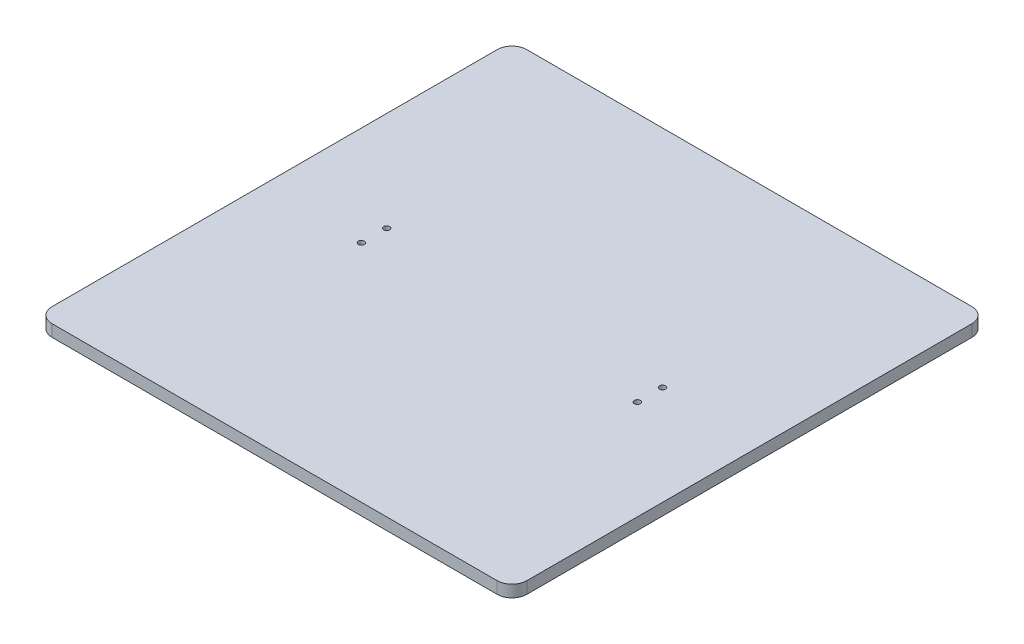
from build123d import *

# Parameters (mm, degrees)
EXTRUDE_1_DEPTH     = 8
CUT_EXTRUDE_1_REACH = 228.416
SKETCH_2_R          = 2


with BuildPart() as part:
    # 草图1 → 凸台-拉伸1 (new body)
    with BuildSketch(Plane(origin=(0, 0, 0), x_dir=(1, 0, 0), z_dir=(0, 1, 0))):
        with BuildLine():
            Line((-150, -160), (150, -160))
            ThreePointArc((150, -160), (157.071067812, -157.071067812), (160, -150))
            Line((160, -150), (160, 150))
            ThreePointArc((160, 150), (157.071067812, 157.071067812), (150, 160))
            Line((150, 160), (-150, 160))
            ThreePointArc((-150, 160), (-157.071067812, 157.071067812), (-160, 150))
            Line((-160, 150), (-160, -150))
            ThreePointArc((-160, -150), (-157.071067812, -157.071067812), (-150, -160))
        make_face()
    extrude(amount=-EXTRUDE_1_DEPTH)

    # 草图2 → 切除-拉伸1 (cut, up to next)
    with BuildSketch(Plane.XZ.offset(8), mode=Mode.PRIVATE) as cut_extrude_1_sk1:
        with Locations(Location((-93, 8.5, 0), (0, 0, 270))):
            Circle(SKETCH_2_R)
    cut_extrude_1_tool1 = extrude(cut_extrude_1_sk1.sketch, amount=-CUT_EXTRUDE_1_REACH, mode=Mode.PRIVATE) & part.part
    # 草图2 → 切除-拉伸1 (cut, up to next)
    with BuildSketch(Plane.XZ.offset(8), mode=Mode.PRIVATE) as cut_extrude_1_sk2:
        with Locations(Location((93, 8.5, 0), (0, 0, 270))):
            Circle(SKETCH_2_R)
    cut_extrude_1_tool2 = extrude(cut_extrude_1_sk2.sketch, amount=-CUT_EXTRUDE_1_REACH, mode=Mode.PRIVATE) & part.part
    # 草图2 → 切除-拉伸1 (cut, up to next)
    with BuildSketch(Plane.XZ.offset(8), mode=Mode.PRIVATE) as cut_extrude_1_sk3:
        with Locations(Location((93, -8.5, 0), (0, 0, 270))):
            Circle(SKETCH_2_R)
    cut_extrude_1_tool3 = extrude(cut_extrude_1_sk3.sketch, amount=-CUT_EXTRUDE_1_REACH, mode=Mode.PRIVATE) & part.part
    # 草图2 → 切除-拉伸1 (cut, up to next)
    with BuildSketch(Plane.XZ.offset(8), mode=Mode.PRIVATE) as cut_extrude_1_sk4:
        with Locations(Location((-93, -8.5, 0), (0, 0, 270))):
            Circle(SKETCH_2_R)
    cut_extrude_1_tool4 = extrude(cut_extrude_1_sk4.sketch, amount=-CUT_EXTRUDE_1_REACH, mode=Mode.PRIVATE) & part.part
    add(cut_extrude_1_tool1.solids().sort_by_distance((-93, -8, 8.5))[0], mode=Mode.SUBTRACT)
    add(cut_extrude_1_tool2.solids().sort_by_distance((93, -8, 8.5))[0], mode=Mode.SUBTRACT)
    add(cut_extrude_1_tool3.solids().sort_by_distance((93, -8, -8.5))[0], mode=Mode.SUBTRACT)
    add(cut_extrude_1_tool4.solids().sort_by_distance((-93, -8, -8.5))[0], mode=Mode.SUBTRACT)


solid = part.part
